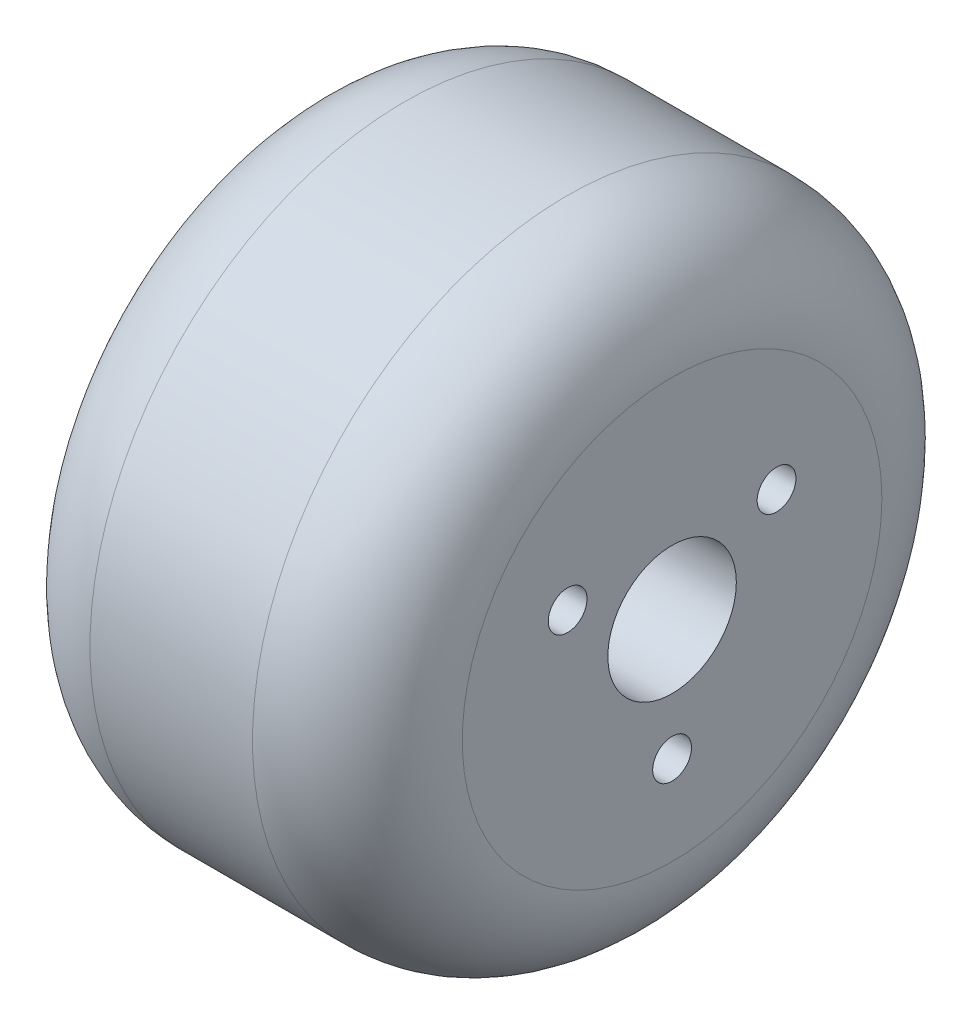
from build123d import *

# Parameters (mm, degrees)
SKETCH1_R           = 30
BOSS_EXTRUDE1_DEPTH = 35.5
SKETCH2_R           = 6.125
SKETCH2_R_2         = 1.85
CUT_EXTRUDE1_DEPTH  = 56.31952639
FILLET1_R           = 10


with BuildPart() as part:
    # Sketch1 → Boss-Extrude1 (new body)
    with BuildSketch(Plane(origin=(0, 0, 0), x_dir=(0, 0, -1), z_dir=(1, 0, 0))):
        Circle(SKETCH1_R)
    extrude(amount=BOSS_EXTRUDE1_DEPTH)

    # Sketch2 → Cut-Extrude1 (cut, through all)
    with BuildSketch(Plane(origin=(35.5, 0, 0), x_dir=(0, 0, -1), z_dir=(1, 0, 0))):
        Circle(SKETCH2_R)
        with Locations((-9.959292144, 5.75)):
            Circle(SKETCH2_R_2)
        with Locations((9.959292144, 5.75)):
            Circle(SKETCH2_R_2)
        with Locations((0, -11.5)):
            Circle(SKETCH2_R_2)
    extrude(amount=-CUT_EXTRUDE1_DEPTH, mode=Mode.SUBTRACT)

    # Fillet1
    fillet1_edges = [part.edges().sort_by_distance(p)[0] for p in [
        (0, 0, 30),
        (35.5, 0, 30),
    ]]
    fillet(fillet1_edges, radius=FILLET1_R)


solid = part.part
